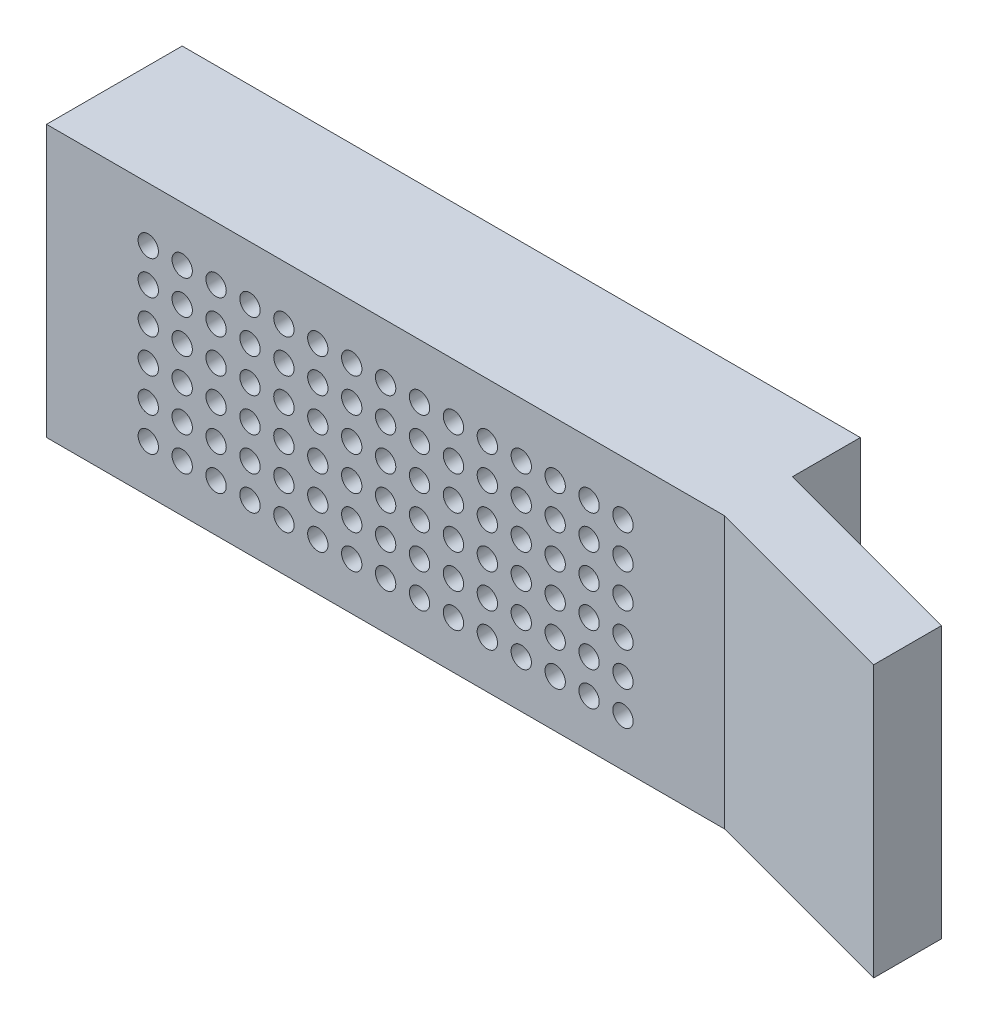
from build123d import *

# Parameters (mm, degrees)
SKETCH_1_W          = 100
SKETCH_1_H          = 40
EXTRUDE_1_DEPTH     = 20
SHELL_1_T           = -3
EXTRUDE_2_DEPTH     = 40
SKETCH_4_R          = 5
EXTRUDE_3_DEPTH     = 20
SKETCH_5_R          = 1.5
CUT_EXTRUDE_1_DEPTH = 16
SKETCH_6_R          = 1.5
CUT_EXTRUDE_2_DEPTH = 10


with BuildPart() as part:
    # 草图1 → 凸台-拉伸1 (new body)
    with BuildSketch(Plane.XY):
        Rectangle(SKETCH_1_W, SKETCH_1_H)
    extrude(amount=EXTRUDE_1_DEPTH)

    # 抽壳1
    shell_1_openings = [part.faces().sort_by_distance(p)[0] for p in [
        (0, 0, 0),
    ]]
    offset(amount=SHELL_1_T, openings=shell_1_openings, kind=Kind.INTERSECTION)

    # 草图3 → 凸台-拉伸2 (add)
    with BuildSketch(Plane(origin=(0, 20, 0), x_dir=(1, 0, 0), z_dir=(0, 1, 0))):
        Polygon((50, -20), (80, -28.038475773), (80, -18.038475773), (50, -10), align=None)
    extrude(amount=-EXTRUDE_2_DEPTH)

    # 草图4 → 凸台-拉伸3 (add)
    with BuildSketch(Plane(origin=(0, 0, 0), x_dir=(-1, 0, 0), z_dir=(0, 0, -1))):
        with Locations((-45, 15)):
            Circle(SKETCH_4_R)
        with Locations((45, 15)):
            Circle(SKETCH_4_R)
        with Locations((45, -15)):
            Circle(SKETCH_4_R)
        with Locations((-45, -15)):
            Circle(SKETCH_4_R)
    extrude(amount=-EXTRUDE_3_DEPTH)

    # 草图5 → 切除-拉伸1 (cut)
    with BuildSketch(Plane(origin=(0, 0, 0), x_dir=(-1, 0, 0), z_dir=(0, 0, -1))):
        with Locations((-45, 15)):
            Circle(SKETCH_5_R)
        with Locations((45, 15)):
            Circle(SKETCH_5_R)
        with Locations((45, -15)):
            Circle(SKETCH_5_R)
        with Locations((-45, -15)):
            Circle(SKETCH_5_R)
    extrude(amount=-CUT_EXTRUDE_1_DEPTH, mode=Mode.SUBTRACT)

    # 草图6 → 切除-拉伸2 (cut)
    with BuildSketch(Plane(origin=(0, 0, 17), x_dir=(-1, 0, 0), z_dir=(0, 0, -1))):
        with Locations((35, 12)):
            Circle(SKETCH_6_R)
        with Locations((30, 12)):
            Circle(SKETCH_6_R)
        with Locations((25, 12)):
            Circle(SKETCH_6_R)
        with Locations((20, 12)):
            Circle(SKETCH_6_R)
        with Locations((15, 12)):
            Circle(SKETCH_6_R)
        with Locations((10, 12)):
            Circle(SKETCH_6_R)
        with Locations((5, 12)):
            Circle(SKETCH_6_R)
        with Locations((0, 12)):
            Circle(SKETCH_6_R)
        with Locations((-5, 12)):
            Circle(SKETCH_6_R)
        with Locations((-10, 12)):
            Circle(SKETCH_6_R)
        with Locations((-15, 12)):
            Circle(SKETCH_6_R)
        with Locations((-20, 12)):
            Circle(SKETCH_6_R)
        with Locations((-25, 12)):
            Circle(SKETCH_6_R)
        with Locations((-30, 12)):
            Circle(SKETCH_6_R)
        with Locations((-35, 12)):
            Circle(SKETCH_6_R)
        with Locations((30, 7)):
            Circle(SKETCH_6_R)
        with Locations((25, 7)):
            Circle(SKETCH_6_R)
        with Locations((20, 7)):
            Circle(SKETCH_6_R)
        with Locations((15, 7)):
            Circle(SKETCH_6_R)
        with Locations((10, 7)):
            Circle(SKETCH_6_R)
        with Locations((5, 7)):
            Circle(SKETCH_6_R)
        with Locations((0, 7)):
            Circle(SKETCH_6_R)
        with Locations((-5, 7)):
            Circle(SKETCH_6_R)
        with Locations((-10, 7)):
            Circle(SKETCH_6_R)
        with Locations((-15, 7)):
            Circle(SKETCH_6_R)
        with Locations((-20, 7)):
            Circle(SKETCH_6_R)
        with Locations((-25, 7)):
            Circle(SKETCH_6_R)
        with Locations((-30, 7)):
            Circle(SKETCH_6_R)
        with Locations((-35, 7)):
            Circle(SKETCH_6_R)
        with Locations((30, 2)):
            Circle(SKETCH_6_R)
        with Locations((25, 2)):
            Circle(SKETCH_6_R)
        with Locations((20, 2)):
            Circle(SKETCH_6_R)
        with Locations((15, 2)):
            Circle(SKETCH_6_R)
        with Locations((10, 2)):
            Circle(SKETCH_6_R)
        with Locations((5, 2)):
            Circle(SKETCH_6_R)
        with Locations((0, 2)):
            Circle(SKETCH_6_R)
        with Locations((-5, 2)):
            Circle(SKETCH_6_R)
        with Locations((-10, 2)):
            Circle(SKETCH_6_R)
        with Locations((-15, 2)):
            Circle(SKETCH_6_R)
        with Locations((-20, 2)):
            Circle(SKETCH_6_R)
        with Locations((-25, 2)):
            Circle(SKETCH_6_R)
        with Locations((-30, 2)):
            Circle(SKETCH_6_R)
        with Locations((-35, 2)):
            Circle(SKETCH_6_R)
        with Locations((30, -3)):
            Circle(SKETCH_6_R)
        with Locations((25, -3)):
            Circle(SKETCH_6_R)
        with Locations((20, -3)):
            Circle(SKETCH_6_R)
        with Locations((15, -3)):
            Circle(SKETCH_6_R)
        with Locations((10, -3)):
            Circle(SKETCH_6_R)
        with Locations((5, -3)):
            Circle(SKETCH_6_R)
        with Locations((0, -3)):
            Circle(SKETCH_6_R)
        with Locations((-5, -3)):
            Circle(SKETCH_6_R)
        with Locations((-10, -3)):
            Circle(SKETCH_6_R)
        with Locations((-15, -3)):
            Circle(SKETCH_6_R)
        with Locations((-20, -3)):
            Circle(SKETCH_6_R)
        with Locations((-25, -3)):
            Circle(SKETCH_6_R)
        with Locations((-30, -3)):
            Circle(SKETCH_6_R)
        with Locations((-35, -3)):
            Circle(SKETCH_6_R)
        with Locations((30, -8)):
            Circle(SKETCH_6_R)
        with Locations((25, -8)):
            Circle(SKETCH_6_R)
        with Locations((20, -8)):
            Circle(SKETCH_6_R)
        with Locations((15, -8)):
            Circle(SKETCH_6_R)
        with Locations((10, -8)):
            Circle(SKETCH_6_R)
        with Locations((5, -8)):
            Circle(SKETCH_6_R)
        with Locations((0, -8)):
            Circle(SKETCH_6_R)
        with Locations((-5, -8)):
            Circle(SKETCH_6_R)
        with Locations((-10, -8)):
            Circle(SKETCH_6_R)
        with Locations((-15, -8)):
            Circle(SKETCH_6_R)
        with Locations((-20, -8)):
            Circle(SKETCH_6_R)
        with Locations((-25, -8)):
            Circle(SKETCH_6_R)
        with Locations((-30, -8)):
            Circle(SKETCH_6_R)
        with Locations((-35, -8)):
            Circle(SKETCH_6_R)
        with Locations((30, -13)):
            Circle(SKETCH_6_R)
        with Locations((25, -13)):
            Circle(SKETCH_6_R)
        with Locations((20, -13)):
            Circle(SKETCH_6_R)
        with Locations((15, -13)):
            Circle(SKETCH_6_R)
        with Locations((10, -13)):
            Circle(SKETCH_6_R)
        with Locations((5, -13)):
            Circle(SKETCH_6_R)
        with Locations((0, -13)):
            Circle(SKETCH_6_R)
        with Locations((-5, -13)):
            Circle(SKETCH_6_R)
        with Locations((-10, -13)):
            Circle(SKETCH_6_R)
        with Locations((-15, -13)):
            Circle(SKETCH_6_R)
        with Locations((-20, -13)):
            Circle(SKETCH_6_R)
        with Locations((-25, -13)):
            Circle(SKETCH_6_R)
        with Locations((-30, -13)):
            Circle(SKETCH_6_R)
        with Locations((-35, -13)):
            Circle(SKETCH_6_R)
        with Locations((35, 7)):
            Circle(SKETCH_6_R)
        with Locations((35, 2)):
            Circle(SKETCH_6_R)
        with Locations((35, -3)):
            Circle(SKETCH_6_R)
        with Locations((35, -8)):
            Circle(SKETCH_6_R)
        with Locations((35, -13)):
            Circle(SKETCH_6_R)
    extrude(amount=-CUT_EXTRUDE_2_DEPTH, mode=Mode.SUBTRACT)


solid = part.part
